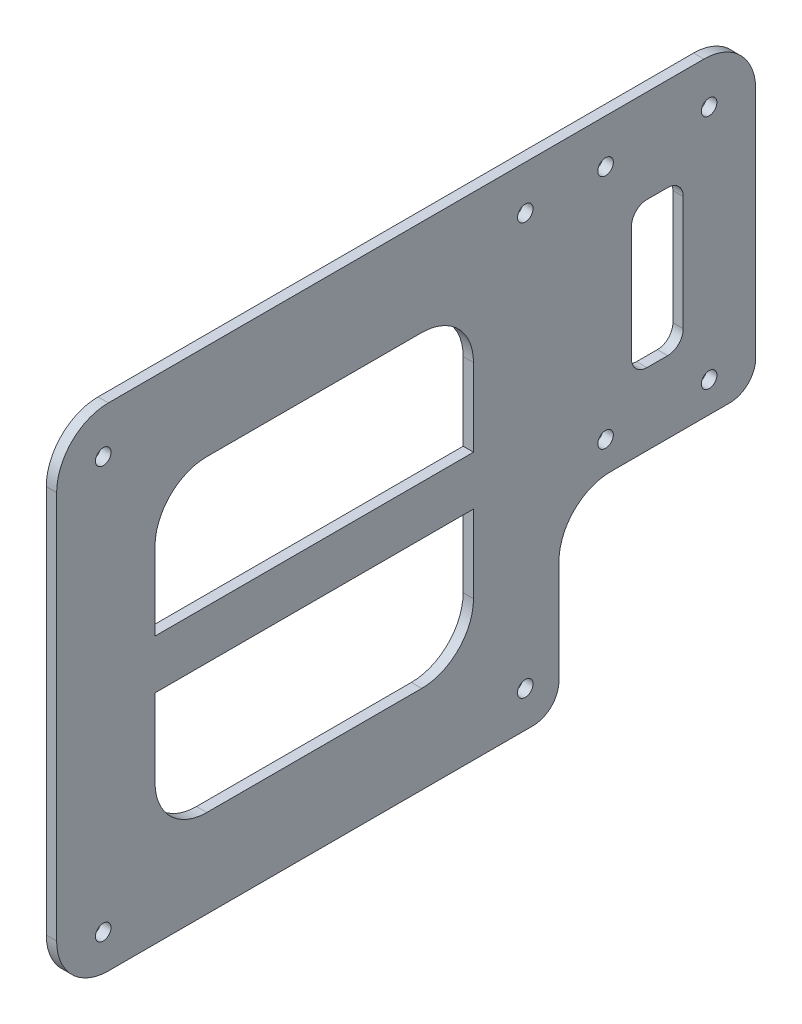
from build123d import *

# Parameters (mm, degrees)
SKETCH2_R           = 1.5
BOSS_EXTRUDE1_DEPTH = 2


with BuildPart() as part:
    # Sketch2 → Boss-Extrude1 (new body)
    with BuildSketch(Plane(origin=(0, 0, 0), x_dir=(0, 0, -1), z_dir=(1, 0, 0))):
        with BuildLine():
            Line((390.798820845, 95), (275.798820845, 95))
            ThreePointArc((275.798820845, 95), (268.727753033, 92.071067812), (265.798820845, 85))
            Line((265.798820845, 85), (265.798820845, 10))
            ThreePointArc((265.798820845, 10), (268.727753033, 2.928932188), (275.798820845, 0))
            Line((275.798820845, 0), (357.798820845, 0))
            ThreePointArc((357.798820845, 0), (361.334354751, 1.464466094), (362.798820845, 5))
            Line((362.798820845, 5), (362.798820845, 25))
            ThreePointArc((362.798820845, 25), (365.727753033, 32.071067812), (372.798820845, 35))
            Line((372.798820845, 35), (395.798820845, 35))
            ThreePointArc((395.798820845, 35), (399.334354751, 36.464466094), (400.798820845, 40))
            Line((400.798820845, 40), (400.798820845, 85))
            ThreePointArc((400.798820845, 85), (397.869888657, 92.071067812), (390.798820845, 95))
        make_face()
        with Locations((371.798820845, 86.5)):
            Circle(SKETCH2_R, mode=Mode.SUBTRACT)
        with Locations((391.798820845, 86.5)):
            Circle(SKETCH2_R, mode=Mode.SUBTRACT)
        with Locations((391.798820845, 40.9)):
            Circle(SKETCH2_R, mode=Mode.SUBTRACT)
        with Locations((371.798820845, 40.9)):
            Circle(SKETCH2_R, mode=Mode.SUBTRACT)
        with Locations((356.298820845, 7)):
            Circle(SKETCH2_R, mode=Mode.SUBTRACT)
        with Locations((274.798820845, 7)):
            Circle(SKETCH2_R, mode=Mode.SUBTRACT)
        with Locations((274.798820845, 86.5)):
            Circle(SKETCH2_R, mode=Mode.SUBTRACT)
        with Locations((356.298820845, 86.5)):
            Circle(SKETCH2_R, mode=Mode.SUBTRACT)
        with BuildLine():
            Line((284.798820845, 42), (346.298820845, 42))
            Line((346.298820845, 42), (346.298820845, 27))
            ThreePointArc((346.298820845, 27), (343.369888657, 19.928932188), (336.298820845, 17))
            Line((336.298820845, 17), (294.798820845, 17))
            ThreePointArc((294.798820845, 17), (287.727753033, 19.928932188), (284.798820845, 27))
            Line((284.798820845, 27), (284.798820845, 42))
        make_face(mode=Mode.SUBTRACT)
        with BuildLine():
            Line((336.298820845, 76.5), (294.798820845, 76.5))
            ThreePointArc((294.798820845, 76.5), (287.727753033, 73.571067812), (284.798820845, 66.5))
            Line((284.798820845, 66.5), (284.798820845, 51.5))
            Line((284.798820845, 51.5), (346.298820845, 51.5))
            Line((346.298820845, 51.5), (346.298820845, 66.5))
            ThreePointArc((346.298820845, 66.5), (343.369888657, 73.571067812), (336.298820845, 76.5))
        make_face(mode=Mode.SUBTRACT)
        with BuildLine():
            Line((383.798820845, 77), (379.798820845, 77))
            ThreePointArc((379.798820845, 77), (377.677500501, 76.121320344), (376.798820845, 74))
            Line((376.798820845, 74), (376.798820845, 51.9))
            ThreePointArc((376.798820845, 51.9), (377.677500501, 49.778679656), (379.798820845, 48.9))
            Line((379.798820845, 48.9), (383.798820845, 48.9))
            ThreePointArc((383.798820845, 48.9), (385.920141188, 49.778679656), (386.798820845, 51.9))
            Line((386.798820845, 51.9), (386.798820845, 74))
            ThreePointArc((386.798820845, 74), (385.920141188, 76.121320344), (383.798820845, 77))
        make_face(mode=Mode.SUBTRACT)
    extrude(amount=BOSS_EXTRUDE1_DEPTH)


solid = part.part
